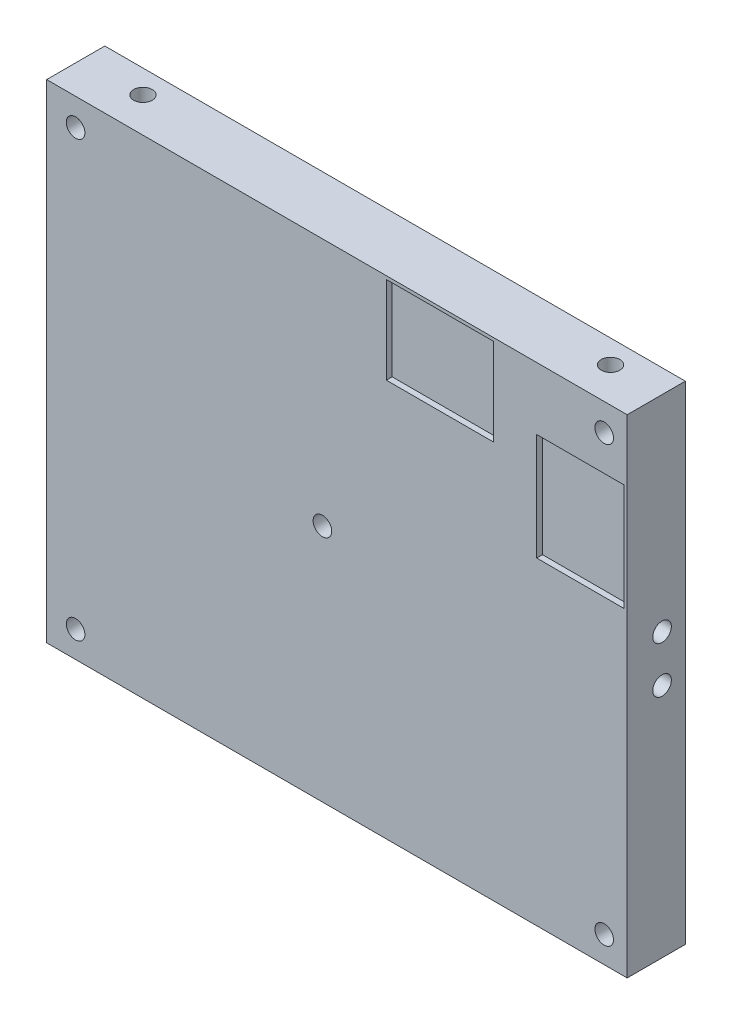
from build123d import *

# Parameters (mm, degrees)
MAIN_STOCK_START                   = -2.751909566
SKETCH_1_W                         = 57.95
SKETCH_1_H                         = 49.98
MAIN_STOCK_DEPTH                   = 5
SKETCH_3_R                         = 0.8
PCB_5XD1P6_M2_THROUGH_DEPTH        = 71.63982517
SKETCH_10_W                        = 7.5
SKETCH_10_H                        = 9.2
TYPEC_BOTTOM_RECESS_A_DEPTH        = 0.5
SKETCH_11_W                        = 9.2
SKETCH_11_H                        = 7.5
TYPEC_BOTTOM_RECESS_B_DEPTH        = 0.5
SKETCH_12_W                        = 62
SKETCH_12_H                        = 54
SKETCH_12_W_2                      = 49.91
SKETCH_12_H_2                      = 41.94
INSET_BASE_PERIMETER_DEPTH         = 5.1
SKETCH_13_R                        = 0.8
HORIZONTAL_BASE_M2_0_0_00028_DEPTH = 5
HORIZONTAL_BASE_M2_0_0_04963_START = -5
SKETCH_14_R                        = 0.8
HORIZONTAL_BASE_M2_0_0_04963_DEPTH = 5
SKETCH_15_R                        = 0.8
HORIZONTAL_BASE_M2_1_0_00028_DEPTH = 5
SKETCH_16_R                        = 0.8
HORIZONTAL_BASE_M2_1_0_04166_DEPTH = 5


with BuildPart() as part:
    # 草图1 → Main_Stock (new body)
    with BuildSketch(Plane.XY.offset(MAIN_STOCK_START)):
        with Locations((24.675, 20.69)):
            Rectangle(SKETCH_1_W, SKETCH_1_H)
    extrude(amount=MAIN_STOCK_DEPTH)

    # 草图3 → PCB_5xD1p6_M2_Through (cut, through all)
    with BuildSketch(Plane.XY.offset(2.248090434)):
        with Locations((23.428293927, 20.276755792)):
            Circle(SKETCH_3_R)
        with Locations((2.206251763, 39.333791606)):
            Circle(SKETCH_3_R)
        with Locations((47.653340917, 39.333791606)):
            Circle(SKETCH_3_R)
        with Locations((47.653340917, 1.976720232)):
            Circle(SKETCH_3_R)
        with Locations((2.206251763, 1.976720232)):
            Circle(SKETCH_3_R)
    extrude(amount=-PCB_5XD1P6_M2_THROUGH_DEPTH, mode=Mode.SUBTRACT)

    # 草图10 → TypeC_Bottom_Recess_A (cut)
    with BuildSketch(Plane.XY.offset(2.248090434)):
        with Locations((45.6, 31.7)):
            Rectangle(SKETCH_10_W, SKETCH_10_H)
    extrude(amount=-TYPEC_BOTTOM_RECESS_A_DEPTH, mode=Mode.SUBTRACT)

    # 草图11 → TypeC_Bottom_Recess_B (cut)
    with BuildSketch(Plane.XY.offset(2.248090434)):
        with Locations((33.523, 37.63)):
            Rectangle(SKETCH_11_W, SKETCH_11_H)
    extrude(amount=-TYPEC_BOTTOM_RECESS_B_DEPTH, mode=Mode.SUBTRACT)

    # 草图12 → Inset_Base_Perimeter (cut)
    with BuildSketch(Plane(origin=(0, 0, -2.751909566), x_dir=(-1, 0, 0), z_dir=(0, 0, -1))):
        with Locations((-25, 21)):
            Rectangle(SKETCH_12_W, SKETCH_12_H)
        with Locations((-24.675, 20.69)):
            Rectangle(SKETCH_12_W_2, SKETCH_12_H_2, mode=Mode.SUBTRACT)
    extrude(amount=-INSET_BASE_PERIMETER_DEPTH, mode=Mode.SUBTRACT)

    # 草图13 → Horizontal_Base_M2_0_-0.00028 (cut)
    with BuildSketch(Plane.ZY.offset(0.28)):
        with Locations((-0.75, 20)):
            Circle(SKETCH_13_R)
        with Locations((-0.75, 33)):
            Circle(SKETCH_13_R)
    extrude(amount=-HORIZONTAL_BASE_M2_0_0_00028_DEPTH, mode=Mode.SUBTRACT)

    # 草图14 → Horizontal_Base_M2_0_0.04963 (cut)
    with BuildSketch(Plane(origin=(49.63, 0, 0), x_dir=(0, 0, -1), z_dir=(1, 0, 0)).offset(HORIZONTAL_BASE_M2_0_0_04963_START)):
        with Locations(Location((0.75, 20, 0), (0, 0, 180))):
            Circle(SKETCH_14_R)
        with Locations((0.75, 24)):
            Circle(SKETCH_14_R)
    extrude(amount=HORIZONTAL_BASE_M2_0_0_04963_DEPTH, mode=Mode.SUBTRACT)

    # 草图15 → Horizontal_Base_M2_1_-0.00028 (cut)
    with BuildSketch(Plane.XZ.offset(0.28)):
        with Locations(Location((14.5, -0.75, 0), (0, 0, 270))):
            Circle(SKETCH_15_R)
        with Locations(Location((34.85, -0.75, 0), (0, 0, 270))):
            Circle(SKETCH_15_R)
    extrude(amount=-HORIZONTAL_BASE_M2_1_0_00028_DEPTH, mode=Mode.SUBTRACT)

    # 草图16 → Horizontal_Base_M2_1_0.04166 (cut)
    with BuildSketch(Plane(origin=(0, 41.66, 0), x_dir=(1, 0, 0), z_dir=(0, 1, 0))):
        with Locations(Location((5, 0.75, 0), (0, 0, 270))):
            Circle(SKETCH_16_R)
        with Locations(Location((45.2, 0.75, 0), (0, 0, 270))):
            Circle(SKETCH_16_R)
    extrude(amount=-HORIZONTAL_BASE_M2_1_0_04166_DEPTH, mode=Mode.SUBTRACT)


solid = part.part
